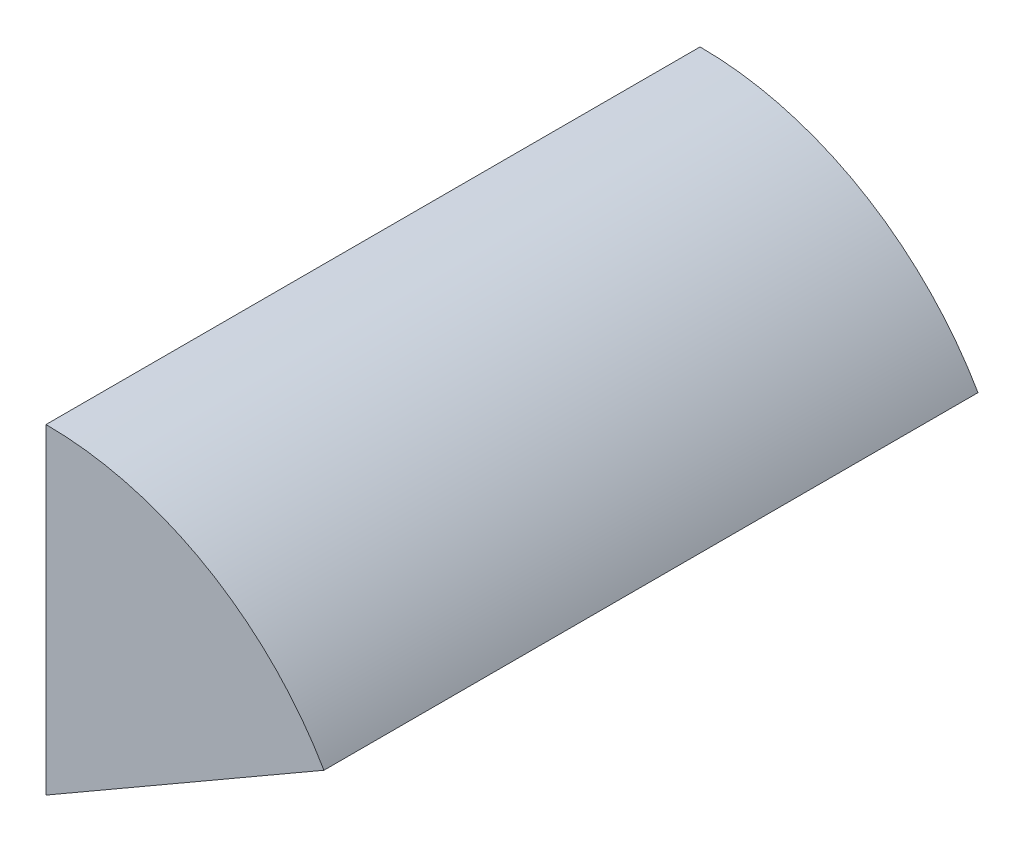
from build123d import *

# Parameters (mm, degrees)
SALIENTE_EXTRUIR1_DEPTH = 50
CROQUIS2_R              = 5
CORTAR_EXTRUIR1_DEPTH   = 10


with BuildPart() as part:
    # Croquis1 → Saliente-Extruir1 (new body)
    with BuildSketch(Plane.XY):
        with BuildLine():
            Line((0, 24.532546265), (0, 0))
            Line((0, 0), (21.245808285, 12.266273133))
            ThreePointArc((21.245808285, 12.266273133), (12.266273133, 21.245808285), (0, 24.532546265))
        make_face()
    extrude(amount=SALIENTE_EXTRUIR1_DEPTH)

    # Croquis2 → Cortar-Extruir1 (cut)
    with BuildSketch(Plane(origin=(0, 0, 0), x_dir=(-1, 0, 0), z_dir=(0, 0, -1))):
        with Locations((-7.562728949, 13.292829801)):
            Circle(CROQUIS2_R)
    extrude(amount=-CORTAR_EXTRUIR1_DEPTH, mode=Mode.SUBTRACT)


solid = part.part
